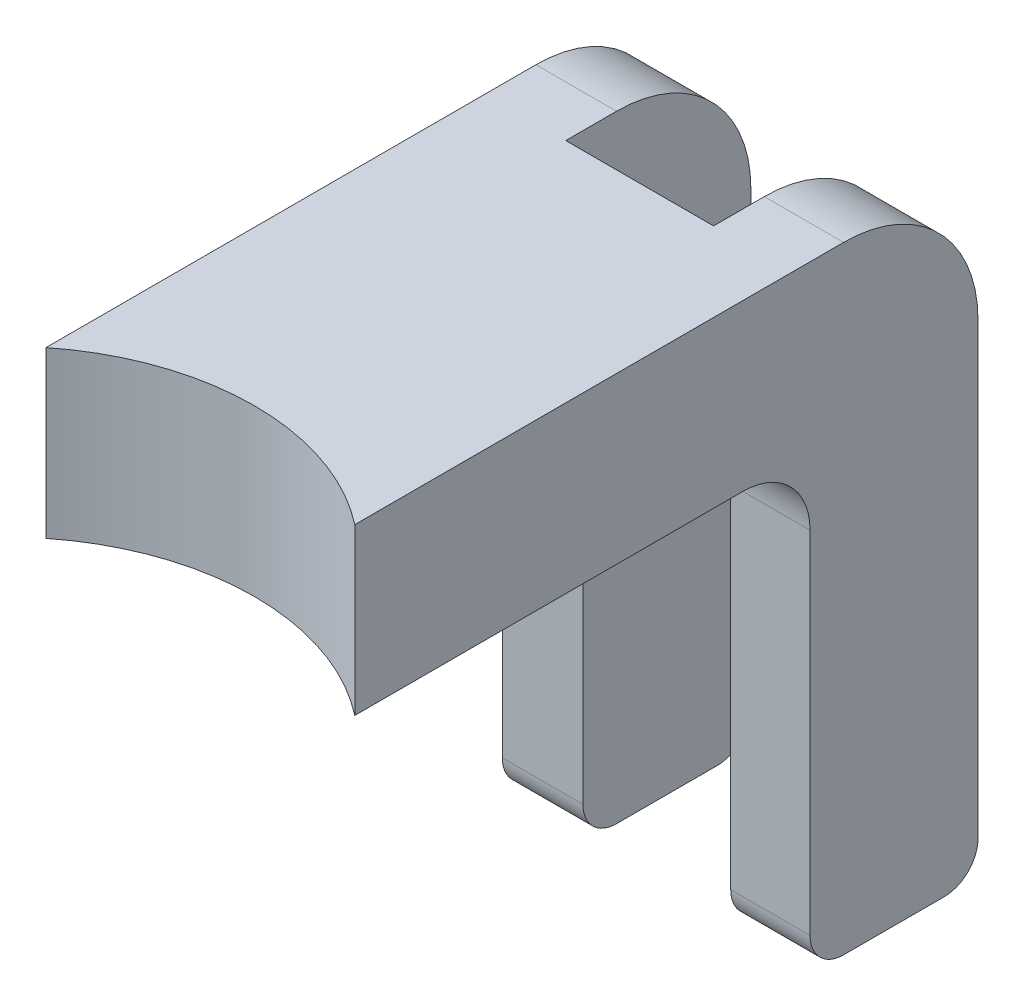
from build123d import *

# Parameters (mm, degrees)
EXTRUDE_START         = -3
EXTRUDE_1_DEPTH       = 46
SKETCH_2_W            = 22
SKETCH_2_H            = 41.003909118
CUT_EXTRUDE_2_DEPTH   = 115
SKETCH_4_W            = 74
SKETCH_4_H            = 24.59688775
EXTRUDE_3_DEPTH       = 55
CUT_EXTRUDE_2_2_DEPTH = 50
FILLET_2_R            = 4
SKETCH_7_R            = 3
CUT_EXTRUDE_3_DEPTH   = 90
FILLET_3_R            = 10
SKETCH_9_W            = 165.264464741
SKETCH_9_H            = 119.978910546
CUT_EXTRUDE_5_DEPTH   = 14.2
SKETCH_10_W           = 169.580693543
SKETCH_10_H           = 115.14513644
CUT_EXTRUDE_6_DEPTH   = 14


with BuildPart() as part:
    # Эскиз1 → Вытянуть1 (new body)
    with BuildSketch(Plane(origin=(0, 0, 0), x_dir=(0, 0, -1), z_dir=(1, 0, 0)).offset(EXTRUDE_START)):
        with BuildLine():
            Line((3.683652722, 0), (3.683652722, -24.59688775))
            Line((3.683652722, -24.59688775), (49.132150834, -24.59688775))
            ThreePointArc((49.132150834, -24.59688775), (56.203218646, -27.525819938), (59.132150834, -34.59688775))
            Line((59.132150834, -34.59688775), (59.132150834, -86.83159597))
            ThreePointArc((59.132150834, -86.83159597), (60.596616928, -90.367129876), (64.132150834, -91.83159597))
            Line((64.132150834, -91.83159597), (79.132150834, -91.83159597))
            ThreePointArc((79.132150834, -91.83159597), (82.66768474, -90.367129876), (84.132150834, -86.83159597))
            Line((84.132150834, -86.83159597), (84.132150834, -20))
            ThreePointArc((84.132150834, -20), (78.274286458, -5.857864376), (64.132150834, 0))
            Line((64.132150834, 0), (3.683652722, 0))
        make_face()
    extrude(amount=EXTRUDE_1_DEPTH)

    # Эскиз2 → Cut-Extrude 2 (cut, symmetric)
    with BuildSketch(Plane(origin=(0, 0, 0), x_dir=(1, 0, 0), z_dir=(0, 1, 0))):
        with Locations((20, 77.079487522)):
            Rectangle(SKETCH_2_W, SKETCH_2_H)
    extrude(amount=CUT_EXTRUDE_2_DEPTH, both=True, mode=Mode.SUBTRACT)

    # Эскиз4 → Вытянуть3 (add)
    with BuildSketch(Plane.XY.offset(-3.683652722)):
        with Locations((20.00338787, -12.298443875)):
            Rectangle(SKETCH_4_W, SKETCH_4_H)
    extrude(amount=EXTRUDE_3_DEPTH)

    # Эскиз6 → Cut-Extrude 2 2 (cut, symmetric)
    with BuildSketch(Plane(origin=(0, 0, 0), x_dir=(1, 0, 0), z_dir=(0, 1, 0))):
        with BuildLine():
            Line((47.00338787, -53.713591308), (47.00338787, -12.467045061))
            ThreePointArc((47.00338787, -12.467045061), (20.003387867, -0.765266351), (-6.99661213, -12.467045078))
            Line((-6.99661213, -12.467045078), (-6.99661213, -53.713591308))
            Line((-6.99661213, -53.713591308), (47.00338787, -53.713591308))
        make_face()
    extrude(amount=CUT_EXTRUDE_2_2_DEPTH, both=True, mode=Mode.SUBTRACT)

    # Скругление2
    fillet_2_edges = [part.edges().sort_by_distance(p)[0] for p in [
        (57.00338787, -12.298443875, -3.683652722),
        (-16.99661213, -12.298443875, -3.683652722),
    ]]
    fillet(fillet_2_edges, radius=FILLET_2_R)

    # Эскиз7 → Вырез-Вытянуть3 (cut, symmetric)
    with BuildSketch(Plane(origin=(57.00338787, 0, 0), x_dir=(0, 0, -1), z_dir=(1, 0, 0))):
        with Locations((-35.623538585, -11.460561108)):
            Circle(SKETCH_7_R)
    extrude(amount=CUT_EXTRUDE_3_DEPTH, both=True, mode=Mode.SUBTRACT)

    # Скругление3
    fillet_3_edges = [part.edges().sort_by_distance(p)[0] for p in [
        (-3, -12.298443875, -3.683652722),
        (43, -12.298443875, -3.683652722),
    ]]
    fillet(fillet_3_edges, radius=FILLET_3_R)

    # Эскиз9 → Вытянуть5 (cut)
    with BuildSketch(Plane(origin=(57.00338787, 0, 0), x_dir=(0, 0, -1), z_dir=(1, 0, 0))):
        with Locations((28.438864211, -53.728415023)):
            Rectangle(SKETCH_9_W, SKETCH_9_H)
    extrude(amount=-CUT_EXTRUDE_5_DEPTH, mode=Mode.SUBTRACT)

    # Эскиз10 → Вытянуть6 (cut)
    with BuildSketch(Plane.ZY.offset(16.99661213)):
        with Locations((-24.768184397, -40.528258671)):
            Rectangle(SKETCH_10_W, SKETCH_10_H)
    extrude(amount=-CUT_EXTRUDE_6_DEPTH, mode=Mode.SUBTRACT)


solid = part.part
